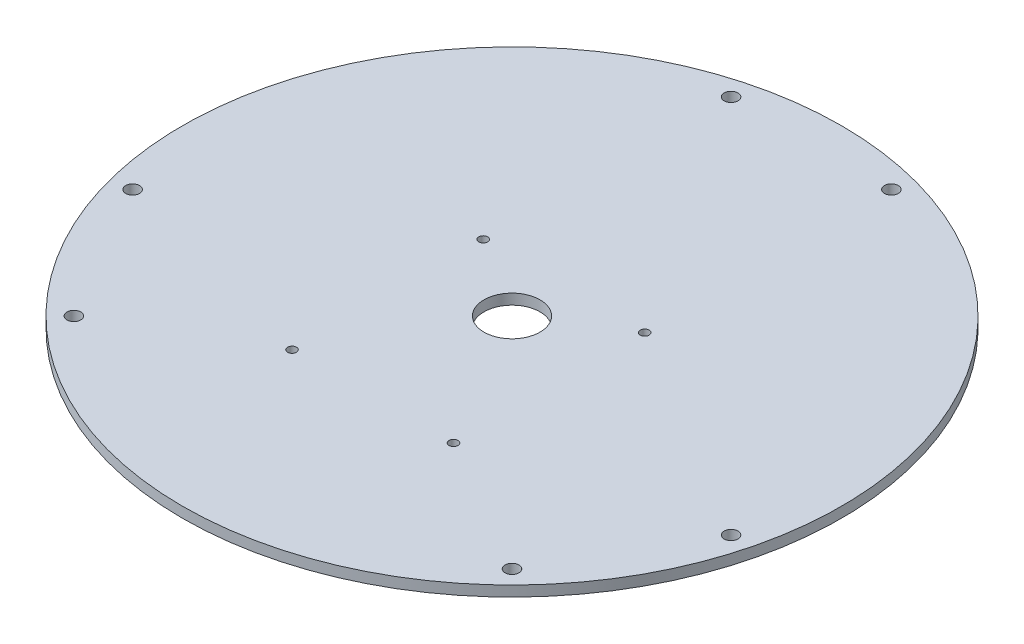
from build123d import *

# Parameters (mm, degrees)
SKETCH1_R           = 100
SKETCH1_R_2         = 2.1
SKETCH1_R_3         = 1.35
SKETCH1_R_4         = 8.5
BOSS_EXTRUDE1_DEPTH = 3.175


with BuildPart() as part:
    # Sketch1 → Boss-Extrude1 (new body)
    with BuildSketch(Plane(origin=(0, 0, 0), x_dir=(1, 0, 0), z_dir=(0, 1, 0))):
        with Locations(Location((0, 0, 0), (0, 0, 270))):
            Circle(SKETCH1_R)
        with Locations(Location((24.32899024, 90.797027671, 0), (0, 0, 270))):
            Circle(SKETCH1_R_2, mode=Mode.SUBTRACT)
        with Locations(Location((-24.32899024, 90.797027671, 0), (0, 0, 90))):
            Circle(SKETCH1_R_2, mode=Mode.SUBTRACT)
        with Locations(Location((90.797027671, -24.32899024, 0), (0, 0, 90))):
            Circle(SKETCH1_R_2, mode=Mode.SUBTRACT)
        with Locations(Location((66.468037432, -66.468037432, 0), (0, 0, 270))):
            Circle(SKETCH1_R_2, mode=Mode.SUBTRACT)
        with Locations(Location((-66.468037432, -66.468037432, 0), (0, 0, 90))):
            Circle(SKETCH1_R_2, mode=Mode.SUBTRACT)
        with Locations(Location((-90.797027671, -24.32899024, 0), (0, 0, 270))):
            Circle(SKETCH1_R_2, mode=Mode.SUBTRACT)
        with Locations(Location((-24.5, -42.25, 0), (0, 0, 270))):
            Circle(SKETCH1_R_3, mode=Mode.SUBTRACT)
        with Locations(Location((24.5, -42.25, 0), (0, 0, 270))):
            Circle(SKETCH1_R_3, mode=Mode.SUBTRACT)
        with Locations(Location((24.5, 15.75, 0), (0, 0, 270))):
            Circle(SKETCH1_R_3, mode=Mode.SUBTRACT)
        with Locations(Location((-24.5, 15.75, 0), (0, 0, 270))):
            Circle(SKETCH1_R_3, mode=Mode.SUBTRACT)
        with Locations(Location((0, 0, 0), (0, 0, 270))):
            Circle(SKETCH1_R_4, mode=Mode.SUBTRACT)
    extrude(amount=BOSS_EXTRUDE1_DEPTH)


solid = part.part
